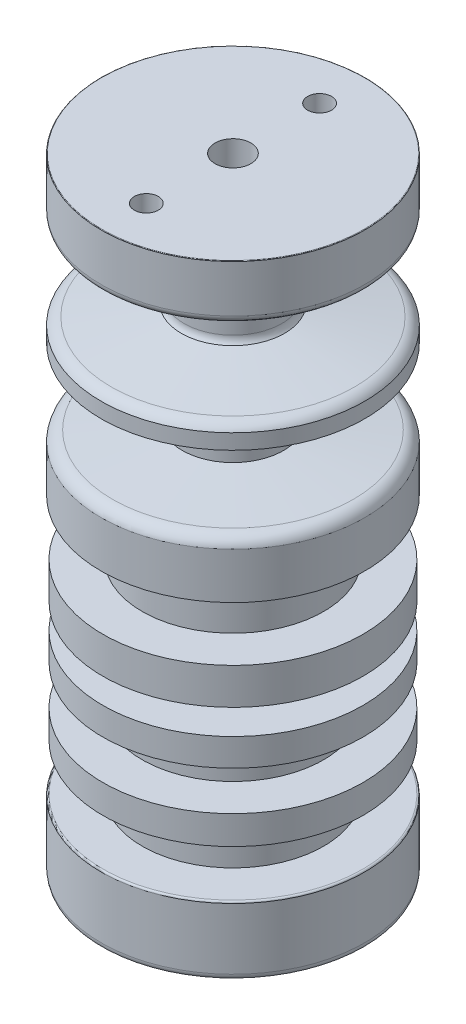
from build123d import *

# Parameters (mm, degrees)
CROQUIS2_R            = 3.175
CORTAR_EXTRUIR2_DEPTH = 12
CROQUIS6_R            = 4.7625
CORTAR_EXTRUIR4_DEPTH = 12
CROQUIS11_R           = 7.9375
CORTAR_EXTRUIR7_DEPTH = 53


with BuildPart() as part:
    # Croquis1 → Revolución3 (revolve)
    with BuildSketch(Plane.XY, mode=Mode.PRIVATE) as revoluci_n3_sk:
        with BuildLine():
            Line((0, 43.044568245), (34.858419682, 43.044568245))
            ThreePointArc((34.858419682, 43.044568245), (34.958532085, 43.00310033), (35, 42.902987927))
            Line((35, 42.902987927), (35, 30.36601493))
            ThreePointArc((35, 30.36601493), (34.403772828, 28.926595206), (32.964353105, 28.330368034))
            Line((32.964353105, 28.330368034), (12.985796912, 28.330368034))
            Line((12.985796912, 28.330368034), (12.985796912, 10.406207601))
            ThreePointArc((12.985796912, 10.406207601), (13.175212613, 9.391052882), (13.717969076, 8.512512712))
            Line((13.717969076, 8.512512712), (32.309744815, 5.485961945))
            ThreePointArc((32.309744815, 5.485961945), (33.884795273, 4.831882369), (35, 3.541563627))
            Line((35, 3.541563627), (35, -0.490098714))
            Line((35, -0.490098714), (13.468735488, -0.490098714))
            Line((13.468735488, -0.490098714), (13.468735488, -18.538757946))
            Line((13.468735488, -18.538757946), (31.979226627, -20.513196287))
            ThreePointArc((31.979226627, -20.513196287), (33.927671218, -21.380602851), (35, -23.224224681))
            Line((35, -23.224224681), (35, -35.501069654))
            Line((35, -35.501069654), (24.086053365, -35.501069654))
            Line((24.086053365, -35.501069654), (24.086053365, -50.263273296))
            Line((24.086053365, -50.263273296), (34.538342083, -50.263273296))
            Line((34.538342083, -50.263273296), (34.538342083, -59.917933312))
            Line((34.538342083, -59.917933312), (24.086053365, -59.917933312))
            Line((24.086053365, -59.917933312), (24.086053365, -66.61708516))
            Line((24.086053365, -66.61708516), (34.538342083, -66.61708516))
            Line((34.538342083, -66.61708516), (34.538342083, -73.907338641))
            Line((34.538342083, -73.907338641), (24.086053365, -73.907338641))
            Line((24.086053365, -73.907338641), (24.086053365, -84.350134169))
            Line((24.086053365, -84.350134169), (34.538342083, -84.350134169))
            Line((34.538342083, -84.350134169), (34.538342083, -91.92338166))
            Line((34.538342083, -91.92338166), (24.086053365, -91.92338166))
            Line((24.086053365, -91.92338166), (24.086053365, -104.221668074))
            Line((24.086053365, -104.221668074), (34.538342083, -104.221668074))
            ThreePointArc((34.538342083, -104.221668074), (34.864783527, -104.356884547), (35, -104.683325991))
            Line((35, -104.683325991), (35, -120.950877143))
            ThreePointArc((35, -120.950877143), (34.933442046, -121.487214162), (34.737806004, -121.991013624))
            Line((34.737806004, -121.991013624), (0, -121.955431755))
            Line((0, -121.955431755), (0, 43.044568245))
        make_face()
    revolve(revoluci_n3_sk.sketch.rotate(Axis((0, 43.044568245, 0), (0, -1, 0)), 180), axis=Axis((0, 43.044568245, 0), (0, -1, 0)))

    # Croquis2 → Cortar-Extruir2 (cut)
    with BuildSketch(Plane(origin=(0, 43.044568245, 0), x_dir=(1, 0, 0), z_dir=(0, 1, 0))):
        with Locations(Location((0, 23, 0), (0, 0, 270))):
            Circle(CROQUIS2_R)
        with Locations(Location((0, -23, 0), (0, 0, 270))):
            Circle(CROQUIS2_R)
    extrude(amount=-CORTAR_EXTRUIR2_DEPTH, mode=Mode.SUBTRACT)

    # Croquis6 → Cortar-Extruir4 (cut)
    with BuildSketch(Plane(origin=(0, 43.044568245, 0), x_dir=(1, 0, 0), z_dir=(0, 1, 0))):
        with Locations(Location((0, 0, 0), (0, 0, 270))):
            Circle(CROQUIS6_R)
    extrude(amount=-CORTAR_EXTRUIR4_DEPTH, mode=Mode.SUBTRACT)

    # Croquis11 → Cortar-Extruir7 (cut)
    with BuildSketch(Plane(origin=(0, -126.955431755, 0), x_dir=(1, 0, 0), z_dir=(0, 1, 0))):
        Circle(CROQUIS11_R)
    extrude(amount=CORTAR_EXTRUIR7_DEPTH, mode=Mode.SUBTRACT)


solid = part.part
